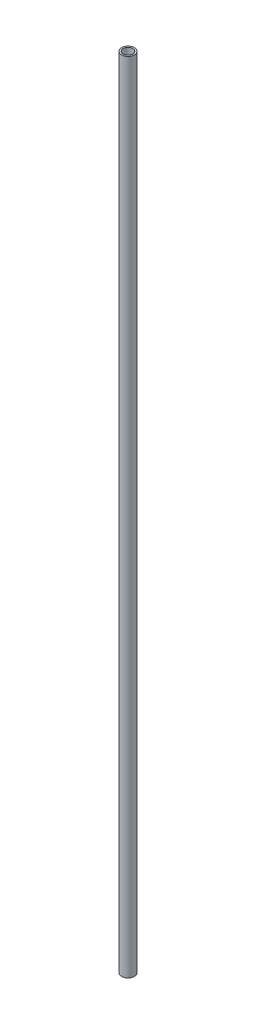
from build123d import *

# Parameters (mm, degrees)
SKETCH_1_R      = 2
SKETCH_1_R_2    = 1.5
EXTRUDE_1_DEPTH = 250


with BuildPart() as part:
    # 草图1 → 凸台-拉伸1 (new body)
    with BuildSketch(Plane(origin=(0, 0, 0), x_dir=(1, 0, 0), z_dir=(0, 1, 0))):
        with Locations(Location((0, 0, 0), (0, 0, 270))):
            Circle(SKETCH_1_R)
        with Locations(Location((0, 0, 0), (0, 0, 270))):
            Circle(SKETCH_1_R_2, mode=Mode.SUBTRACT)
    extrude(amount=EXTRUDE_1_DEPTH)


solid = part.part
